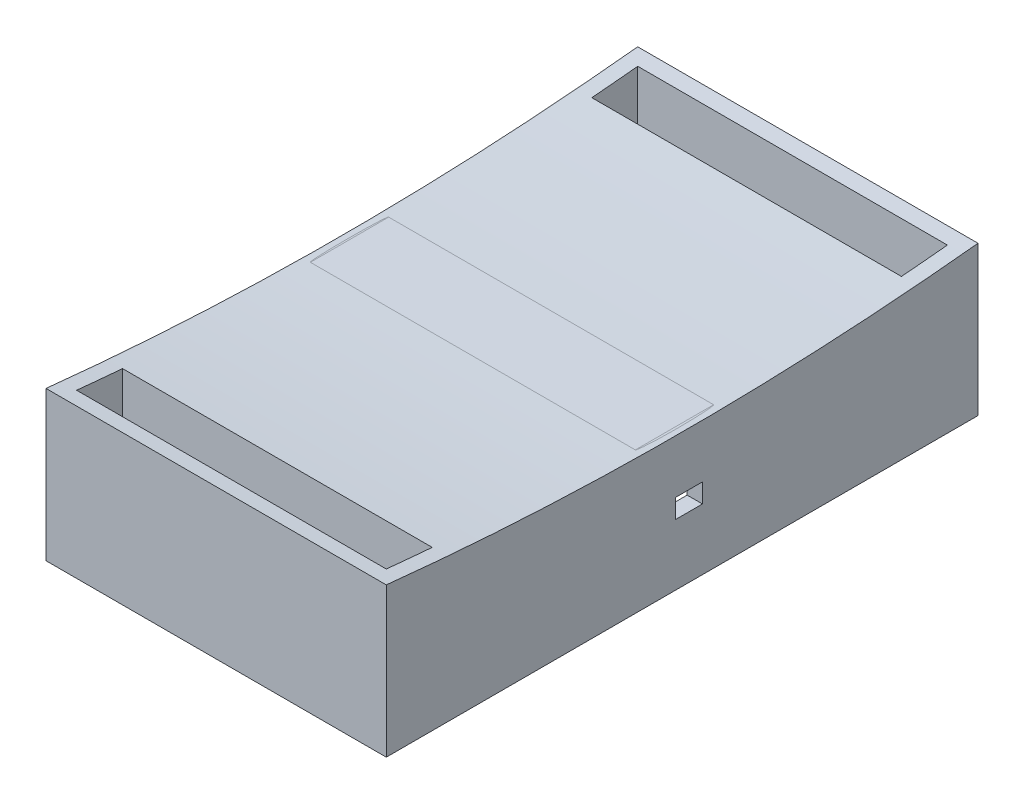
from build123d import *

# Parameters (mm, degrees)
SKETCH2_W               = 40.46
SKETCH2_H               = 55.31
BOSS_EXTRUDE1_DEPTH     = 2
SKETCH3_R               = 4
SKETCH3_R_2             = 1.5
BOSS_EXTRUDE2_DEPTH     = 4
FILLET1_R               = 2
SKETCH6_W               = 44.46
SKETCH6_H               = 59.31
SKETCH6_W_2             = 40.46
SKETCH6_H_2             = 55.31
BOSS_EXTRUDE3_DEPTH     = 17.5
SKETCH9_W               = 0.75
SKETCH9_H               = 5
CUT_EXTRUDE1_DEPTH      = 5
FILLET3_R               = 1
FILLET4_R               = 0.5
SKETCH12_W              = 44.46
SKETCH12_H              = 10
SKETCH12_W_2            = 40.46
SKETCH12_H_2            = 6
BOSS_EXTRUDE4_DEPTH     = 8
FILLET5_R               = 1
CUT_EXTRUDE2_DEPTH      = 10
CUT_EXTRUDE2_DEPTH_BACK = 8
SKETCH11_W              = 2
SKETCH11_H              = 2
SKETCH13_W              = 3.5
SKETCH13_H              = 2.5
CUT_EXTRUDE3_DEPTH      = 8
BOSS_EXTRUDE5_REACH     = 64.535
CUT_EXTRUDE4_DEPTH      = 48.832070201
CUT_EXTRUDE4_DEPTH_BACK = 48.832070201
SKETCH16_W              = 40.46
SKETCH16_H              = 6
SKETCH19_W              = 44.46
SKETCH19_H              = 10
SKETCH19_W_2            = 40.46
SKETCH19_H_2            = 6
BOSS_EXTRUDE7_DEPTH     = 9.5
SKETCH20_W              = 2
SKETCH20_H              = 2
CUT_EXTRUDE5_DEPTH      = 5


with BuildPart() as part:
    # Sketch2 → Boss-Extrude1 (new body)
    with BuildSketch(Plane(origin=(0, 0, 0), x_dir=(1, 0, 0), z_dir=(0, 1, 0))):
        with Locations((0, -2.5)):
            Rectangle(SKETCH2_W, SKETCH2_H)
    extrude(amount=BOSS_EXTRUDE1_DEPTH)

    # Sketch3 → Boss-Extrude2 (add)
    # profile 1 of 2: a face of its own
    with BuildSketch(Plane.XZ):
        with Locations(Location((-12.92, -17.845, 0), (0, 0, 90))):
            Circle(SKETCH3_R)
        with Locations(Location((-12.92, -17.845, 0), (0, 0, 270))):
            Circle(SKETCH3_R_2, mode=Mode.SUBTRACT)
    # profile 2 of 2: a face of its own
    with BuildSketch(Plane.XZ):
        with Locations(Location((11.5, -17.845, 0), (0, 0, 90))):
            Circle(SKETCH3_R)
        with Locations(Location((11.5, -17.845, 0), (0, 0, 270))):
            Circle(SKETCH3_R_2, mode=Mode.SUBTRACT)
    extrude(amount=BOSS_EXTRUDE2_DEPTH)

    # Fillet1
    fillet1_edges = [part.edges().sort_by_distance(p)[0] for p in [
        (-12.92, 0, -21.845),
        (11.5, 0, -21.845),
    ]]
    fillet(fillet1_edges, radius=FILLET1_R)

    # Sketch6 → Boss-Extrude3 (add)
    with BuildSketch(Plane(origin=(0, 2, 0), x_dir=(1, 0, 0), z_dir=(0, 1, 0))):
        with Locations((0, -2.5)):
            Rectangle(SKETCH6_W, SKETCH6_H)
        with Locations((0, -2.5)):
            Rectangle(SKETCH6_W_2, SKETCH6_H_2, mode=Mode.SUBTRACT)
    extrude(amount=-BOSS_EXTRUDE3_DEPTH)

    # Cut-Sweep1: sweep along a curve in space
    with BuildLine() as cut_sweep1_path:
        Line((-20.23, -15.5, -25.155), (-20.23, -15.5, 30.155))
    # Sketch9 → Cut-Sweep1 (sweep, cut)
    with BuildSketch(Plane(origin=(0, 0, 30.155), x_dir=(-1, 0, 0), z_dir=(0, 0, -1))):
        with Locations((20.605, -13)):
            Rectangle(SKETCH9_W, SKETCH9_H)
        with Locations((-20.605, -13)):
            Rectangle(SKETCH9_W, SKETCH9_H)
    sweep(path=cut_sweep1_path.line, mode=Mode.SUBTRACT)

    # Sketch10 → Cut-Extrude1 (cut)
    with BuildSketch(Plane.XZ.offset(15.5)):
        Polygon((-20.23, 30.155), (20.23, 30.155), (20.98, 30.155), (20.98, 30.905), (-20.98, 30.905), (-20.98, 30.155), align=None)
        Polygon((20.23, -25.155), (-20.23, -25.155), (-20.98, -25.155), (-20.98, -25.905), (20.98, -25.905), (20.98, -25.155), align=None)
    extrude(amount=-CUT_EXTRUDE1_DEPTH, mode=Mode.SUBTRACT)

    # Fillet3
    fillet3_edges = [part.edges().sort_by_distance(p)[0] for p in [
        (22.23, -6.75, 32.155),
        (22.23, -6.75, -27.155),
        (-22.23, -6.75, -27.155),
        (-22.23, -6.75, 32.155),
        (0, 2, -27.155),
        (22.23, 2, 2.5),
        (0, 2, 32.155),
        (-22.23, 2, 2.5),
        (-20.23, -5.25, 30.155),
        (-20.23, -5.25, -25.155),
        (20.23, -5.25, -25.155),
        (20.23, -5.25, 30.155),
        (0, 0, 30.155),
        (-20.23, 0, 2.5),
        (0, 0, -25.155),
        (20.23, 0, 2.5),
    ]]
    fillet(fillet3_edges, radius=FILLET3_R)

    # Fillet4
    fillet4_edges = [part.edges().sort_by_distance(p)[0] for p in [
        (20.98, -13, -25.905),
        (-20.98, -13, -25.905),
        (-20.98, -13, 30.905),
        (20.98, -13, 30.905),
    ]]
    fillet(fillet4_edges, radius=FILLET4_R)

    # Sketch12 → Boss-Extrude4 (add)
    # profile 1 of 2: a face of its own
    with BuildSketch(Plane(origin=(0, 2, 0), x_dir=(1, 0, 0), z_dir=(0, 1, 0))):
        with Locations((0, 31.155)):
            Rectangle(SKETCH12_W, SKETCH12_H)
        with Locations((0, 31.155)):
            Rectangle(SKETCH12_W_2, SKETCH12_H_2, mode=Mode.SUBTRACT)
    # profile 2 of 2: a face of its own
    with BuildSketch(Plane(origin=(0, 2, 0), x_dir=(1, 0, 0), z_dir=(0, 1, 0))):
        with Locations((0, -36.155)):
            Rectangle(SKETCH12_W, SKETCH12_H)
        with Locations((0, -36.155)):
            Rectangle(SKETCH12_W_2, SKETCH12_H_2, mode=Mode.SUBTRACT)
    extrude(amount=-BOSS_EXTRUDE4_DEPTH)

    # Fillet5
    fillet5_edges = [part.edges().sort_by_distance(p)[0] for p in [
        (-22.23, 2, 36.155),
        (-22.23, 2, -31.155),
        (22.23, 2, 36.155),
        (22.23, 2, -31.155),
    ]]
    fillet(fillet5_edges, radius=FILLET5_R)

    # Sketch11 → Cut-Extrude2 (cut, two sides: drawn at the far end of the back side and taken through both)
    with BuildSketch(Plane(origin=(0, 0, -27.155), x_dir=(-1, 0, 0), z_dir=(0, 0, -1)).offset(-CUT_EXTRUDE2_DEPTH_BACK)):
        with Locations((8.73, -8)):
            Rectangle(SKETCH11_W, SKETCH11_H)
    extrude(amount=CUT_EXTRUDE2_DEPTH + CUT_EXTRUDE2_DEPTH_BACK, mode=Mode.SUBTRACT)

    # Sketch13 → Cut-Extrude3 (cut)
    with BuildSketch(Plane(origin=(22.23, 0, 0), x_dir=(0, 0, -1), z_dir=(1, 0, 0))):
        with Locations((-1.595, -6.25)):
            Rectangle(SKETCH13_W, SKETCH13_H)
    extrude(amount=-CUT_EXTRUDE3_DEPTH, mode=Mode.SUBTRACT)

    # Boss-Extrude5: up to this face of the body (flat: up to its plane)
    boss_extrude5_end = Plane(part.part.faces().sort_by_distance((-22.23, -6.637443983, 2.5))[0])
    # Sketch14 → Boss-Extrude5 (add, up to the picked face)
    with BuildSketch(Plane(origin=(22.23, 0, 0), x_dir=(0, 0, -1), z_dir=(1, 0, 0)), mode=Mode.PRIVATE) as boss_extrude5_sk1:
        with BuildLine():
            Line((36.155, 4), (36.155, 1))
            Line((36.155, 1), (-41.155, 1))
            Line((-41.155, 1), (-41.155, 4))
            ThreePointArc((-41.155, 4), (-2.5, 1.964478359), (36.155, 4))
        make_face()
    boss_extrude5_tool1 = split(extrude(boss_extrude5_sk1.sketch, amount=-BOSS_EXTRUDE5_REACH, mode=Mode.PRIVATE), bisect_by=boss_extrude5_end, keep=Keep.BOTH, mode=Mode.PRIVATE)
    add(boss_extrude5_tool1.solids().sort_by(Axis((22.23, 1.933161, 2.5), (-1, 0, 0)))[0])

    # Sketch16 → Cut-Extrude4 (cut, two sides: drawn at the far end of the back side and taken through both)
    with BuildSketch(Plane.XZ.offset(6).offset(-CUT_EXTRUDE4_DEPTH_BACK)):
        with Locations((0, 36.155)):
            Rectangle(SKETCH16_W, SKETCH16_H)
        with Locations((0, -31.155)):
            Rectangle(SKETCH16_W, SKETCH16_H)
    extrude(amount=CUT_EXTRUDE4_DEPTH + CUT_EXTRUDE4_DEPTH_BACK, mode=Mode.SUBTRACT)

    # Sketch19 → Boss-Extrude7 (add)
    # profile 1 of 2: a face of its own
    with BuildSketch(Plane.XZ.offset(6)):
        with Locations((0, -31.155)):
            Rectangle(SKETCH19_W, SKETCH19_H)
        with Locations((0, -31.155)):
            Rectangle(SKETCH19_W_2, SKETCH19_H_2, mode=Mode.SUBTRACT)
    # profile 2 of 2: a face of its own
    with BuildSketch(Plane.XZ.offset(6)):
        with Locations((0, 36.155)):
            Rectangle(SKETCH19_W, SKETCH19_H)
        with Locations((0, 36.155)):
            Rectangle(SKETCH19_W_2, SKETCH19_H_2, mode=Mode.SUBTRACT)
    extrude(amount=BOSS_EXTRUDE7_DEPTH)

    # Sketch20 → Cut-Extrude5 (cut)
    with BuildSketch(Plane.XY.offset(-26.155)):
        with Locations((-8.73, -8)):
            Rectangle(SKETCH20_W, SKETCH20_H)
    extrude(amount=-CUT_EXTRUDE5_DEPTH, mode=Mode.SUBTRACT)


solid = part.part
